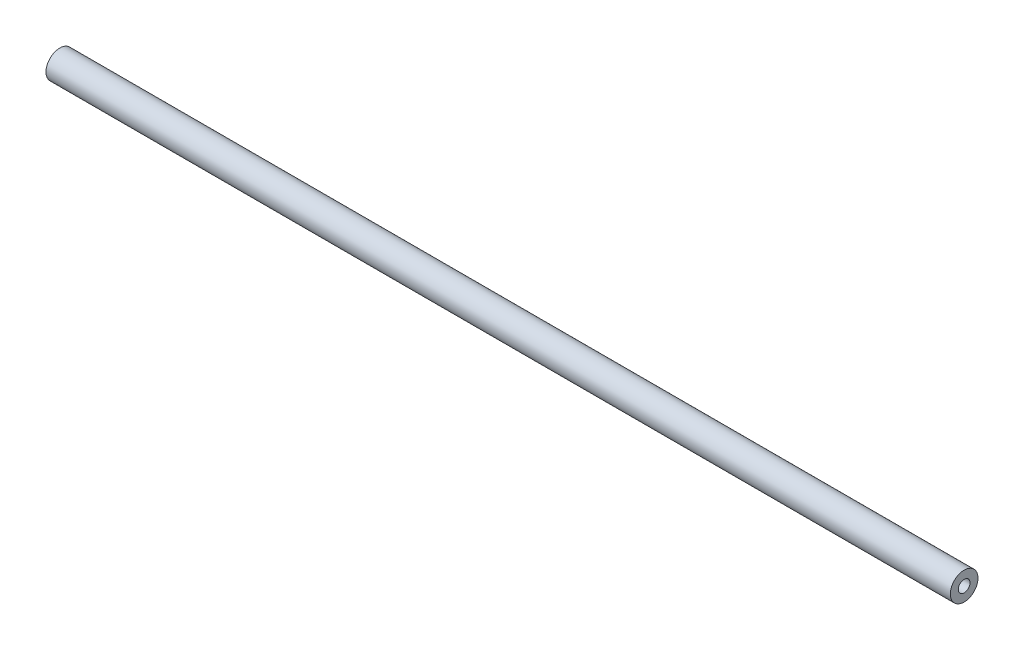
from build123d import *

# Parameters (mm, degrees)
SKETCH1_R                            = 4.7625
BOSS_EXTRUDE1_DEPTH                  = 155.575
F_10_32_TAPPED_HOLE1_D               = 4.0386
F_10_32_TAPPED_HOLE1_DEPTH           = 12.02944
F_10_32_TAPPED_HOLE1_TIP             = 1.213317848
F_10_32_TAPPED_HOLE1_ON_FACE_2_D     = 4.0386
F_10_32_TAPPED_HOLE1_ON_FACE_2_DEPTH = 12.02944
F_10_32_TAPPED_HOLE1_ON_FACE_2_TIP   = 1.213317848


with BuildPart() as part:
    # Sketch1 → Boss-Extrude1 (new, symmetric)
    with BuildSketch(Plane(origin=(0, 0, 0), x_dir=(0, 0, -1), z_dir=(1, 0, 0))):
        Circle(SKETCH1_R)
    extrude(amount=BOSS_EXTRUDE1_DEPTH, both=True)

    # #10-32 Tapped Hole1
    with Locations(Plane(origin=(155.575, 0, 0), x_dir=(0, 0, 1), z_dir=(1, 0, 0))):
        with Locations((0, 0)):
            Hole(F_10_32_TAPPED_HOLE1_D / 2, depth=F_10_32_TAPPED_HOLE1_DEPTH)
            with Locations((0, 0, -(F_10_32_TAPPED_HOLE1_DEPTH + F_10_32_TAPPED_HOLE1_TIP / 2))):  # 118° drill point
                Cone(0, F_10_32_TAPPED_HOLE1_D / 2, F_10_32_TAPPED_HOLE1_TIP, mode=Mode.SUBTRACT)

    # #10-32 Tapped Hole1 on face 2
    with Locations(Plane(origin=(-155.575, 0, 0), x_dir=(0, 0, -1), z_dir=(-1, 0, 0))):
        with Locations((0, 0)):
            Hole(F_10_32_TAPPED_HOLE1_ON_FACE_2_D / 2, depth=F_10_32_TAPPED_HOLE1_ON_FACE_2_DEPTH)
            with Locations((0, 0, -(F_10_32_TAPPED_HOLE1_ON_FACE_2_DEPTH + F_10_32_TAPPED_HOLE1_ON_FACE_2_TIP / 2))):  # 118° drill point
                Cone(0, F_10_32_TAPPED_HOLE1_ON_FACE_2_D / 2, F_10_32_TAPPED_HOLE1_ON_FACE_2_TIP, mode=Mode.SUBTRACT)


solid = part.part
